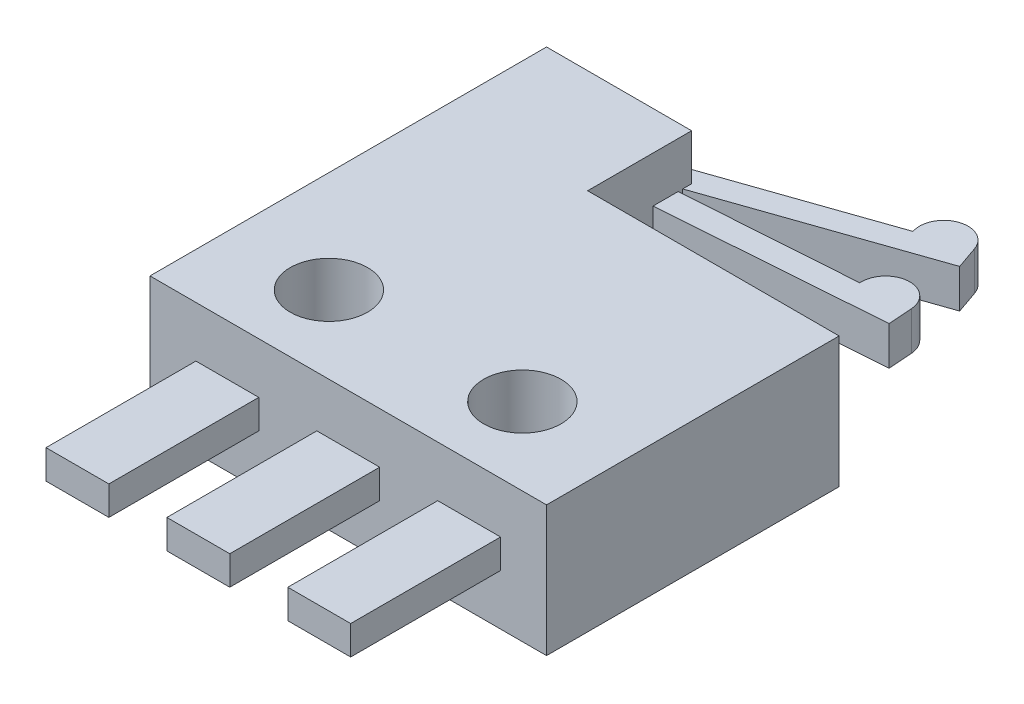
from build123d import *

# Parameters (mm, degrees)
SKETCH1_W                 = 3
SKETCH1_H                 = 2.15
SKETCH1_W_2               = 8.2
SKETCH1_H_2               = 6.05
BODY_DEPTH                = 2.7
PINS_DEPTH                = 0.3
PINS_DEPTH_BACK           = 0.3
SKETCH2_W                 = 1.3
SKETCH2_H                 = 3.1
SKETCH3_R                 = 0.8
M1_6HOLES_DEPTH           = 12.906720791
FREEPOSITION_DEPTH        = 0.4
FREEPOSITION_DEPTH_BACK   = 0.4
OPERATINGPOINT_DEPTH      = 0.4
OPERATINGPOINT_DEPTH_BACK = 0.4


with BuildPart() as part:
    # Sketch1 → Body (new body)
    with BuildSketch(Plane(origin=(0, 0, 0), x_dir=(1, 0, 0), z_dir=(0, 1, 0))):
        with Locations((1.5, 7.125)):
            Rectangle(SKETCH1_W, SKETCH1_H)
        with Locations((4.1, 3.025)):
            Rectangle(SKETCH1_W_2, SKETCH1_H_2)
    extrude(amount=BODY_DEPTH)

    # Sketch2 → Pins (add, two sides: drawn at the far end of the back side and taken through both)
    with BuildSketch(Plane(origin=(0, 1.35, 0), x_dir=(1, 0, 0), z_dir=(0, 1, 0)).offset(-PINS_DEPTH_BACK)):
        with Locations((1.6, -1.55)):
            Rectangle(SKETCH2_W, SKETCH2_H)
        with Locations((4.1, -1.55)):
            Rectangle(SKETCH2_W, SKETCH2_H)
        with Locations((6.6, -1.55)):
            Rectangle(SKETCH2_W, SKETCH2_H)
    extrude(amount=PINS_DEPTH + PINS_DEPTH_BACK)

    # Sketch3 → M1.6Holes (cut, through all)
    with BuildSketch(Plane(origin=(0, 2.7, 0), x_dir=(1, 0, 0), z_dir=(0, 1, 0))):
        with Locations(Location((2.1, 1.6, 0), (0, 0, 270))):
            Circle(SKETCH3_R)
        with Locations(Location((6.1, 1.6, 0), (0, 0, 270))):
            Circle(SKETCH3_R)
    extrude(amount=-M1_6HOLES_DEPTH, mode=Mode.SUBTRACT)

    # Sketch4 → FreePosition (add, two sides: drawn at the far end of the back side and taken through both)
    with BuildSketch(Plane(origin=(0, 1.35, 0), x_dir=(1, 0, 0), z_dir=(0, 1, 0)).offset(-FREEPOSITION_DEPTH_BACK)):
        with BuildLine():
            ThreePointArc((7.115151319, 9.8), (7.022559042, 9.510139779), (6.779075529, 9.32763483))
            Line((6.779075529, 9.32763483), (7.251440659, 9.491558958))
            Line((7.251440659, 9.491558958), (7.08751651, 9.963924149))
            ThreePointArc((7.08751651, 9.963924149), (7.108194216, 9.883118604), (7.115151319, 9.8))
        make_face()
        with BuildLine():
            ThreePointArc((6.142786129, 9.636075851), (6.146132258, 9.626733962), (6.149663119, 9.617460317))
            Line((6.149663119, 9.617460317), (6.615151319, 9.8))
            Line((6.615151319, 9.8), (6.142786129, 9.636075851))
        make_face()
        with BuildLine():
            Line((6.615151319, 9.8), (6.149663119, 9.617460317))
            ThreePointArc((6.149663119, 9.617460317), (6.40602238, 9.345835837), (6.779075529, 9.32763483))
            ThreePointArc((6.779075529, 9.32763483), (7.022559042, 9.510139779), (7.115151319, 9.8))
            ThreePointArc((7.115151319, 9.8), (7.108194216, 9.883118604), (7.08751651, 9.963924149))
            ThreePointArc((7.08751651, 9.963924149), (6.45122717, 10.272365191), (6.142786129, 9.636075851))
            Line((6.142786129, 9.636075851), (6.615151319, 9.8))
        make_face()
        with BuildLine():
            Line((6.149663119, 9.617460317), (0.75, 7.5))
            Line((0.75, 7.5), (0.75, 7.235374235))
            Line((0.75, 7.235374235), (6.779075529, 9.32763483))
            ThreePointArc((6.779075529, 9.32763483), (6.40602238, 9.345835837), (6.149663119, 9.617460317))
        make_face()
        with BuildLine():
            Line((0.75, 7.764625765), (0.75, 7.5))
            Line((0.75, 7.5), (6.149663119, 9.617460317))
            ThreePointArc((6.149663119, 9.617460317), (6.146132258, 9.626733962), (6.142786129, 9.636075851))
            Line((6.142786129, 9.636075851), (0.75, 7.764625765))
        make_face()
    extrude(amount=FREEPOSITION_DEPTH + FREEPOSITION_DEPTH_BACK)

    # Sketch5 → OperatingPoint (add, two sides: drawn at the far end of the back side and taken through both)
    with BuildSketch(Plane(origin=(0, 1.35, 0), x_dir=(1, 0, 0), z_dir=(0, 1, 0)).offset(-OPERATINGPOINT_DEPTH_BACK)):
        with BuildLine():
            Line((0.75, 7.764625765), (0.75, 7.235374235))
            Line((0.75, 7.235374235), (7.047885091, 7.701363081))
            ThreePointArc((7.047885091, 7.701363081), (6.6836512, 7.822046181), (6.51219484, 8.165314959))
            Line((6.51219484, 8.165314959), (0.75, 7.764625765))
        make_face()
        with BuildLine():
            ThreePointArc((7.510990337, 8.2), (7.377355849, 7.859740817), (7.047885091, 7.701363081))
            Line((7.047885091, 7.701363081), (7.544317529, 7.738094773))
            Line((7.544317529, 7.738094773), (7.509785834, 8.234685041))
            ThreePointArc((7.509785834, 8.234685041), (7.510689121, 8.217352975), (7.510990337, 8.2))
        make_face()
        with BuildLine():
            ThreePointArc((6.51219484, 8.165314959), (6.6836512, 7.822046181), (7.047885091, 7.701363081))
            ThreePointArc((7.047885091, 7.701363081), (7.377355849, 7.859740817), (7.510990337, 8.2))
            ThreePointArc((7.510990337, 8.2), (7.510689121, 8.217352975), (7.509785834, 8.234685041))
            Line((7.509785834, 8.234685041), (7.010990337, 8.2))
            Line((7.010990337, 8.2), (6.51219484, 8.165314959))
        make_face()
        with BuildLine():
            ThreePointArc((7.509785834, 8.234685041), (6.976305296, 8.698795497), (6.51219484, 8.165314959))
            Line((6.51219484, 8.165314959), (7.010990337, 8.2))
            Line((7.010990337, 8.2), (7.509785834, 8.234685041))
        make_face()
    extrude(amount=OPERATINGPOINT_DEPTH + OPERATINGPOINT_DEPTH_BACK)


solid = part.part
